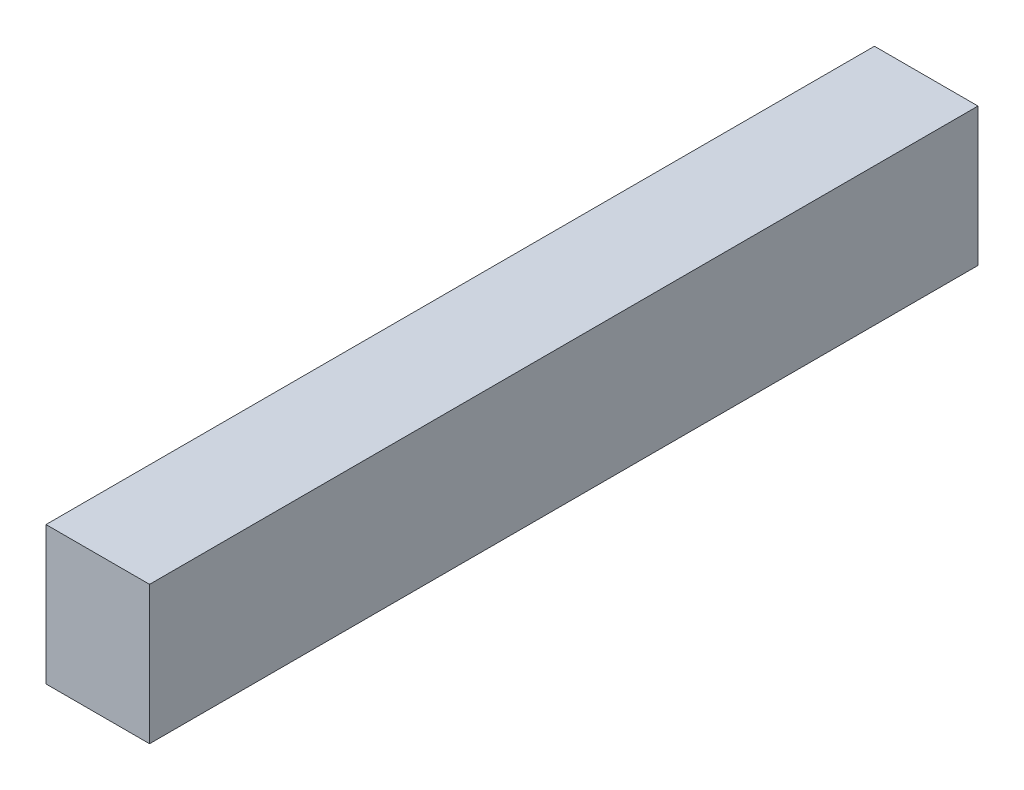
from build123d import *

# Parameters (mm, degrees)
SKETCH1_W           = 9.525
SKETCH1_H           = 12.7
BOSS_EXTRUDE1_DEPTH = 76.2


with BuildPart() as part:
    # Sketch1 → Boss-Extrude1 (new body)
    with BuildSketch(Plane.XY):
        with Locations((0.560294118, -1.307352941)):
            Rectangle(SKETCH1_W, SKETCH1_H)
    extrude(amount=BOSS_EXTRUDE1_DEPTH)


solid = part.part
